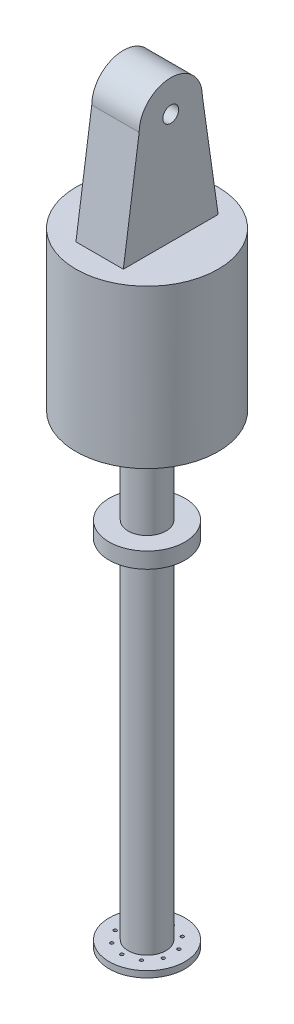
from build123d import *

# Parameters (mm, degrees)
SKETCH2_R            = 2.5
BOSS_EXTRUDE2_DEPTH  = 15
SKETCH3_R            = 22.5
BOSS_EXTRUDE16_DEPTH = 39
BOSS_EXTRUDE22_START = -5
SKETCH3_4_R          = 22.5
BOSS_EXTRUDE22_DEPTH = 5
BOSS_EXTRUDE23_START = 6
SKETCH7_R            = 22.5
BOSS_EXTRUDE23_DEPTH = 6
SKETCH8_R            = 6
BOSS_EXTRUDE25_DEPTH = 30
SKETCH9_R            = 12
BOSS_EXTRUDE27_DEPTH = 5
SKETCH10_R           = 6
BOSS_EXTRUDE28_DEPTH = 110
SKETCH11_R           = 12
SKETCH11_R_2         = 0.5
BOSS_EXTRUDE30_DEPTH = 2


with BuildPart() as part:
    # Sketch2 → Boss-Extrude2 (new body)
    with BuildSketch(Plane(origin=(0, 0, 0), x_dir=(0, 0, -1), z_dir=(1, 0, 0))):
        with BuildLine():
            Line((-10, 64), (-15, 29))
            Line((-15, 29), (15, 29))
            Line((15, 29), (10, 64))
            ThreePointArc((10, 64), (0, 74), (-10, 64))
        make_face()
        with Locations((0, 64)):
            Circle(SKETCH2_R, mode=Mode.SUBTRACT)
    extrude(amount=BOSS_EXTRUDE2_DEPTH)

    # Sketch3 → Boss-Extrude16 (add)
    with BuildSketch(Plane(origin=(0, -10, 0), x_dir=(1, 0, 0), z_dir=(0, 1, 0))):
        with Locations(Location((7.5, 0, 0), (0, 0, 270))):
            Circle(SKETCH3_R)
    extrude(amount=BOSS_EXTRUDE16_DEPTH)

    # Sketch3<4> → Boss-Extrude22 (add)
    with BuildSketch(Plane(origin=(0, -10, 0), x_dir=(1, 0, 0), z_dir=(0, 1, 0)).offset(BOSS_EXTRUDE22_START)):
        with Locations(Location((7.5, 0, 0), (0, 0, 270))):
            Circle(SKETCH3_4_R)
    extrude(amount=BOSS_EXTRUDE22_DEPTH)

    # Sketch7 → Boss-Extrude23 (add)
    with BuildSketch(Plane.XZ.offset(15).offset(BOSS_EXTRUDE23_START)):
        with Locations(Location((7.5, 0, 0), (0, 0, 270))):
            Circle(SKETCH7_R)
    extrude(amount=-BOSS_EXTRUDE23_DEPTH)

    # Sketch8 → Boss-Extrude25 (add)
    with BuildSketch(Plane.XZ.offset(21)):
        with Locations(Location((7.5, 0, 0), (0, 0, 270))):
            Circle(SKETCH8_R)
    extrude(amount=BOSS_EXTRUDE25_DEPTH)

    # Sketch9 → Boss-Extrude27 (add)
    with BuildSketch(Plane.XZ.offset(51)):
        with Locations(Location((7.5, 0, 0), (0, 0, 270))):
            Circle(SKETCH9_R)
    extrude(amount=BOSS_EXTRUDE27_DEPTH)

    # Sketch10 → Boss-Extrude28 (add)
    with BuildSketch(Plane.XZ.offset(56)):
        with Locations(Location((7.5, 0, 0), (0, 0, 270))):
            Circle(SKETCH10_R)
    extrude(amount=BOSS_EXTRUDE28_DEPTH)

    # Sketch11 → Boss-Extrude30 (add)
    with BuildSketch(Plane.XZ.offset(166)):
        with Locations(Location((7.5, 0, 0), (0, 0, 270))):
            Circle(SKETCH11_R)
        with Locations(Location((7.5, 8, 0), (0, 0, 270))):
            Circle(SKETCH11_R_2, mode=Mode.SUBTRACT)
        with Locations(Location((2.797717982, 6.472135955, 0), (0, 0, 270))):
            Circle(SKETCH11_R_2, mode=Mode.SUBTRACT)
        with Locations(Location((-0.10845213, 2.472135955, 0), (0, 0, 270))):
            Circle(SKETCH11_R_2, mode=Mode.SUBTRACT)
        with Locations(Location((2.797717982, -6.472135955, 0), (0, 0, 270))):
            Circle(SKETCH11_R_2, mode=Mode.SUBTRACT)
        with Locations(Location((-0.10845213, -2.472135955, 0), (0, 0, 270))):
            Circle(SKETCH11_R_2, mode=Mode.SUBTRACT)
        with Locations(Location((7.5, -8, 0), (0, 0, 270))):
            Circle(SKETCH11_R_2, mode=Mode.SUBTRACT)
        with Locations(Location((12.202282018, -6.472135955, 0), (0, 0, 270))):
            Circle(SKETCH11_R_2, mode=Mode.SUBTRACT)
        with Locations(Location((15.10845213, -2.472135955, 0), (0, 0, 270))):
            Circle(SKETCH11_R_2, mode=Mode.SUBTRACT)
        with Locations(Location((15.10845213, 2.472135955, 0), (0, 0, 270))):
            Circle(SKETCH11_R_2, mode=Mode.SUBTRACT)
        with Locations(Location((12.202282018, 6.472135955, 0), (0, 0, 270))):
            Circle(SKETCH11_R_2, mode=Mode.SUBTRACT)
    extrude(amount=BOSS_EXTRUDE30_DEPTH)


solid = part.part
